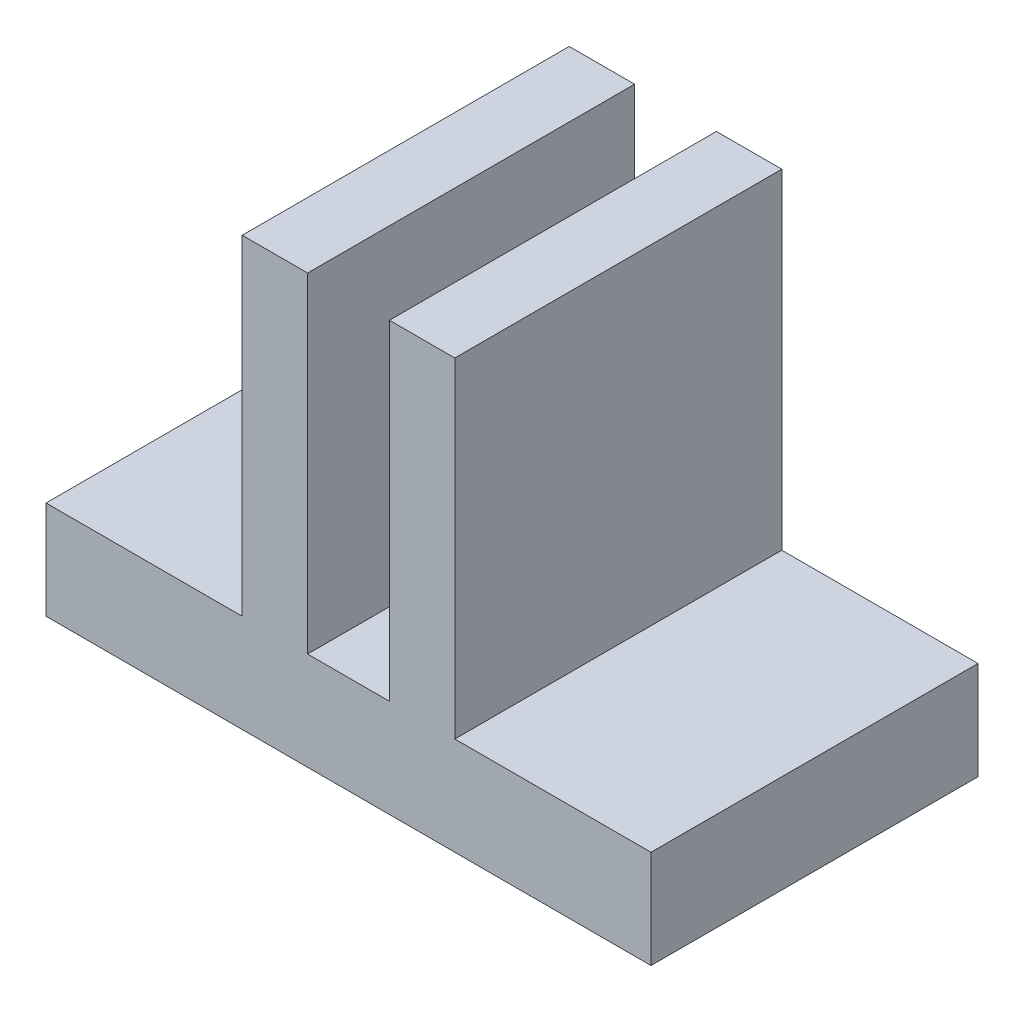
from build123d import *

# Parameters (mm, degrees)
BOSS_EXTRUDE2_DEPTH = 50


with BuildPart() as part:
    # Sketch2 → Boss-Extrude2 (new body)
    with BuildSketch(Plane.XY):
        Polygon((-48.760088365, -8.337817051), (-18.760088365, -8.337817051), (-18.760088365, 42.116160745), (-8.760088365, 42.116160745), (-8.760088365, -8.337817051), (3.746637212, -8.337817051), (3.746637212, 42.116160745), (13.746637212, 42.116160745), (13.746637212, -8.337817051), (43.746637212, -8.337817051), (43.746637212, -23.337817051), (-48.760088365, -23.337817051), align=None)
    extrude(amount=BOSS_EXTRUDE2_DEPTH)


solid = part.part
